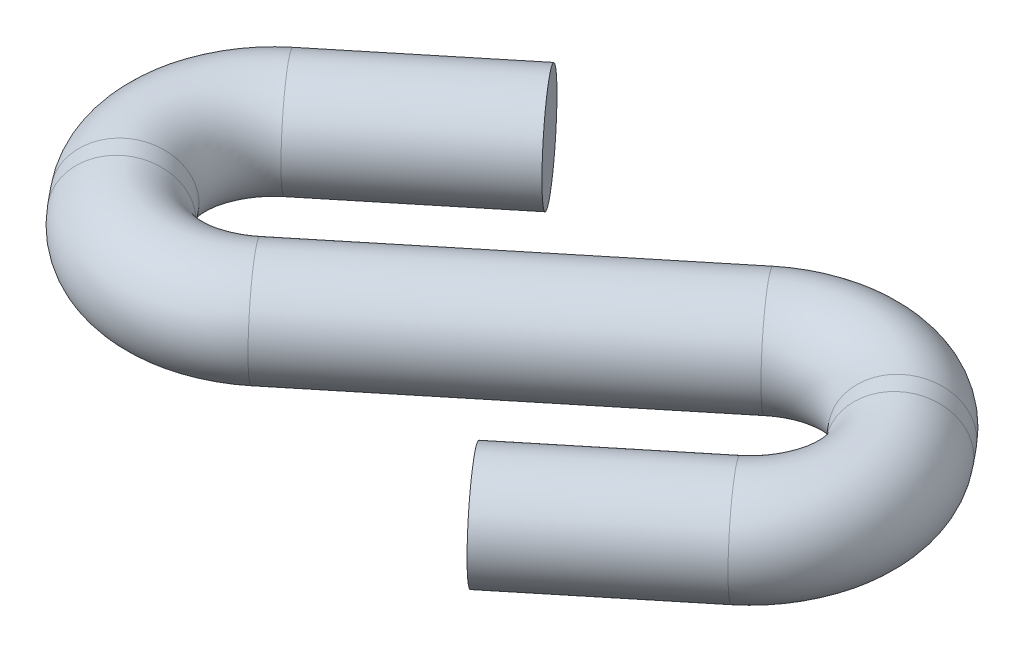
from build123d import *

# Parameters (mm, degrees)
SWEEP1_PROFILE_R = 0.5


with BuildPart() as part:
    # Sweep1: sweep along a path in Sketch1
    with BuildLine(Plane(origin=(0, 0, 0), x_dir=(1, 0, 0), z_dir=(0, 1, 0))) as sweep1_path:
        Line((1.368734727, -1.722638222), (2.725693934, -0.613646403))
        ThreePointArc((2.725693934, -0.613646403), (3.087864871, 0.060607741), (2.86718872, 0.793470943))
        Line((2.86718872, 0.793470943), (2.740626464, 0.948332156))
        ThreePointArc((2.740626464, 0.948332156), (2.06637232, 1.310503094), (1.333509118, 1.089826942))
        Line((1.333509118, 1.089826942), (-1.333509118, -1.089826942))
        ThreePointArc((-1.333509118, -1.089826942), (-2.06637232, -1.310503094), (-2.740626464, -0.948332156))
        Line((-2.740626464, -0.948332156), (-2.86718872, -0.793470943))
        ThreePointArc((-2.86718872, -0.793470943), (-3.087864871, -0.060607741), (-2.725693934, 0.613646403))
        Line((-2.725693934, 0.613646403), (-1.368734727, 1.722638222))
    # Sweep1 profile (on start of the path) → Sweep1 (sweep)
    with BuildSketch(Plane(origin=(1.368734727, 0, 1.722638222), x_dir=(0.632811280257266, 0, 0.7743060658287264), z_dir=(0.7743060658287264, 0, -0.632811280257266))):
        Circle(SWEEP1_PROFILE_R)
    sweep(path=sweep1_path.line)


solid = part.part
